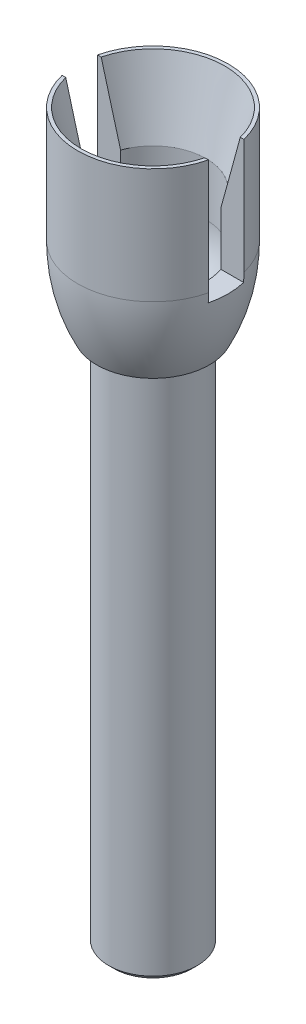
from build123d import *

# Parameters (mm, degrees)
ENL_V_MAT_EXTRU_1_REACH             = 43.438
ESQUISSE2_W                         = 2
ESQUISSE2_H                         = 7
ENL_V_MAT_EXTRU_1_DIRECTION_2_REACH = 43.438


with BuildPart() as part:
    # Esquisse1 → Révolution1 (revolve)
    with BuildSketch(Plane.XY, mode=Mode.PRIVATE) as r_volution1_sk:
        with BuildLine():
            Line((0, 0), (-2.2, 0))
            Line((-2.2, 0), (-2.5, 0.3))
            Line((-2.5, 0.3), (-2.5, 30))
            Line((-2.5, 30), (-3.18028555, 30))
            ThreePointArc((-3.18028555, 30), (-3.978896533, 32.187301954), (-4.25, 34.5))
            Line((-4.25, 34.5), (-4.25, 41))
            Line((-4.25, 41), (-4.05, 41))
            Line((-4.05, 41), (-3, 37))
            Line((-3, 37), (-3, 34))
            ThreePointArc((-3, 34), (-2.121320344, 31.878679656), (0, 31))
            Line((0, 31), (0, 0))
        make_face()
    revolve(r_volution1_sk.sketch.rotate(Axis((0, -1.292585524, 0), (0, 1, 0)), 270), axis=Axis((0, -1.292585524, 0), (0, 1, 0)))

    # Esquisse2 → Enlèv. mat.-Extru.1 (cut, up to next)
    with BuildSketch(Plane(origin=(0, 0, 0), x_dir=(0, 0, -1), z_dir=(1, 0, 0)), mode=Mode.PRIVATE) as enl_v_mat_extru_1_sk1:
        with Locations((0, 37.5)):
            Rectangle(ESQUISSE2_W, ESQUISSE2_H)
    enl_v_mat_extru_1_tool1 = extrude(enl_v_mat_extru_1_sk1.sketch, amount=-ENL_V_MAT_EXTRU_1_REACH, mode=Mode.PRIVATE) & part.part
    add(enl_v_mat_extru_1_tool1.solids().sort_by_distance((0, 37.5, 0))[0], mode=Mode.SUBTRACT)

    # Esquisse2 → Enlèv. mat.-Extru.1 direction 2 (cut, up to next)
    with BuildSketch(Plane(origin=(0, 0, 0), x_dir=(0, 0, -1), z_dir=(1, 0, 0)), mode=Mode.PRIVATE) as enl_v_mat_extru_1_direction_2_sk1:
        with Locations((0, 37.5)):
            Rectangle(ESQUISSE2_W, ESQUISSE2_H)
    enl_v_mat_extru_1_direction_2_tool1 = extrude(enl_v_mat_extru_1_direction_2_sk1.sketch, amount=ENL_V_MAT_EXTRU_1_DIRECTION_2_REACH, mode=Mode.PRIVATE) & part.part
    add(enl_v_mat_extru_1_direction_2_tool1.solids().sort_by_distance((0, 37.5, 0))[0], mode=Mode.SUBTRACT)


solid = part.part
